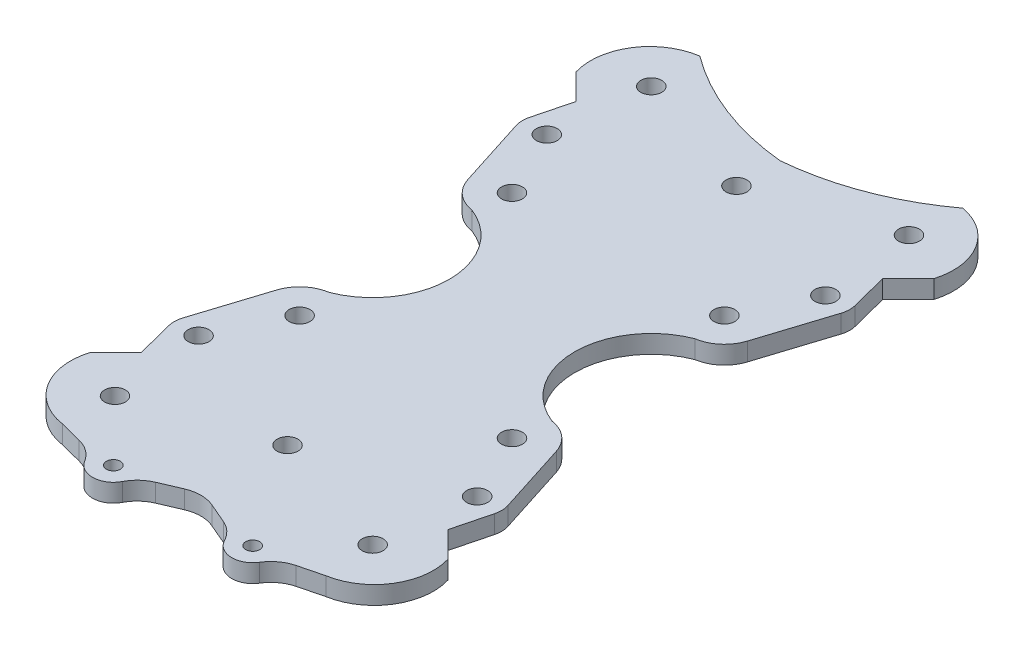
from build123d import *

# Parameters (mm, degrees)
SKETCH1_R           = 1.5
BOSS_EXTRUDE1_DEPTH = 2.6
BOSS_EXTRUDE2_START = -2.6
SKETCH2_R           = 1.5
BOSS_EXTRUDE2_DEPTH = 2.6
SKETCH3_R           = 1.5
SKETCH3_R_2         = 11
CUT_EXTRUDE2_DEPTH  = 2.6
SKETCH4_R           = 1.5
BOSS_EXTRUDE3_DEPTH = 2.6
BOSS_EXTRUDE5_START = -2.6
SKETCH5_R           = 1
BOSS_EXTRUDE5_DEPTH = 2.6
FILLET1_R           = 5


with BuildPart() as part:
    # Sketch1 → Boss-Extrude1 (new body)
    with BuildSketch(Plane(origin=(0, 0, 0), x_dir=(1, 0, 0), z_dir=(0, 1, 0))):
        with BuildLine():
            ThreePointArc((168.347792712, 1300.859692621), (159.343486253, 1295.942873675), (149.343647654, 1293.65030495))
            ThreePointArc((149.343647654, 1293.65030495), (139.460555114, 1295.990018463), (130.567766275, 1300.895941835))
            ThreePointArc((130.567766275, 1300.895941835), (124.616810573, 1297.0492589), (123.648598599, 1290.029756856))
            Line((123.648598599, 1290.029756856), (131.000501903, 1282.677853551))
            ThreePointArc((131.000501903, 1282.677853551), (132.734683914, 1280.082466761), (133.343647654, 1277.020999302))
            Line((133.343647654, 1277.020999302), (133.343647654, 1272.65030495))
            Line((133.343647654, 1272.65030495), (133.343647654, 1269.65030495))
            Line((133.343647654, 1269.65030495), (133.343647654, 1240.65030495))
            Line((133.343647654, 1240.65030495), (133.343647654, 1237.65030495))
            Line((133.343647654, 1237.65030495), (133.343647654, 1233.279610599))
            ThreePointArc((133.343647654, 1233.279610599), (132.734683914, 1230.21814314), (131.000501903, 1227.622756349))
            Line((131.000501903, 1227.622756349), (123.648598599, 1220.270853045))
            ThreePointArc((123.648598599, 1220.270853045), (124.616810573, 1213.251351001), (130.567766275, 1209.404668065))
            ThreePointArc((130.567766275, 1209.404668065), (139.460555114, 1214.310591438), (149.343647654, 1216.65030495))
            ThreePointArc((149.343647654, 1216.65030495), (159.343486253, 1214.357736226), (168.347792712, 1209.44091728))
            ThreePointArc((168.347792712, 1209.44091728), (174.131892083, 1213.349250607), (175.038696709, 1220.270853045))
            Line((175.038696709, 1220.270853045), (167.686793404, 1227.622756349))
            ThreePointArc((167.686793404, 1227.622756349), (165.952611394, 1230.21814314), (165.343647654, 1233.279610599))
            Line((165.343647654, 1233.279610599), (165.343647654, 1237.65030495))
            Line((165.343647654, 1237.65030495), (165.343647654, 1240.65030495))
            Line((165.343647654, 1240.65030495), (165.343647654, 1269.65030495))
            Line((165.343647654, 1269.65030495), (165.343647654, 1272.65030495))
            Line((165.343647654, 1272.65030495), (165.343647654, 1277.020999302))
            ThreePointArc((165.343647654, 1277.020999302), (165.952611394, 1280.082466761), (167.686793404, 1282.677853551))
            Line((167.686793404, 1282.677853551), (175.038696709, 1290.029756856))
            ThreePointArc((175.038696709, 1290.029756856), (174.131892083, 1296.951359294), (168.347792712, 1300.859692621))
        make_face()
        with Locations(Location((130.843647654, 1216.65030495, 0), (0, 0, 270))):
            Circle(SKETCH1_R, mode=Mode.SUBTRACT)
        with Locations(Location((149.343647654, 1222.919184261, 0), (0, 0, 270))):
            Circle(SKETCH1_R, mode=Mode.SUBTRACT)
        with Locations(Location((167.843647654, 1216.65030495, 0), (0, 0, 270))):
            Circle(SKETCH1_R, mode=Mode.SUBTRACT)
        with Locations(Location((130.843647654, 1293.65030495, 0), (0, 0, 270))):
            Circle(SKETCH1_R, mode=Mode.SUBTRACT)
        with Locations(Location((149.343647654, 1287.38142564, 0), (0, 0, 270))):
            Circle(SKETCH1_R, mode=Mode.SUBTRACT)
        with BuildLine():
            ThreePointArc((169.343647654, 1293.65030495), (167.843647654, 1292.15030495), (166.343647654, 1293.65030495))
            ThreePointArc((166.343647654, 1293.65030495), (167.843647654, 1295.15030495), (169.343647654, 1293.65030495))
        make_face(mode=Mode.SUBTRACT)
    extrude(amount=BOSS_EXTRUDE1_DEPTH)

    # Sketch2 → Boss-Extrude2 (add)
    # profile 1 of 4: a face of its own
    with BuildSketch(Plane(origin=(0, 2.6, 0), x_dir=(1, 0, 0), z_dir=(0, 1, 0)).offset(BOSS_EXTRUDE2_START)):
        with BuildLine():
            Line((171.362745056, 1223.946804697), (172.733437461, 1229.278912352))
            ThreePointArc((172.733437461, 1229.278912352), (172.109499611, 1232.295080685), (169.343647654, 1233.65030495))
            Line((169.343647654, 1233.65030495), (165.343647654, 1233.279610599))
            ThreePointArc((165.343647654, 1233.279610599), (165.952611394, 1230.21814314), (167.686793404, 1227.622756349))
            Line((167.686793404, 1227.622756349), (171.362745056, 1223.946804697))
        make_face()
        with Locations(Location((169.343647654, 1230.15030495, 0), (0, 0, 270))):
            Circle(SKETCH2_R, mode=Mode.SUBTRACT)
    # profile 2 of 4: a face of its own
    with BuildSketch(Plane(origin=(0, 2.6, 0), x_dir=(1, 0, 0), z_dir=(0, 1, 0)).offset(BOSS_EXTRUDE2_START)):
        with BuildLine():
            Line((127.324550251, 1223.946804697), (131.000501903, 1227.622756349))
            ThreePointArc((131.000501903, 1227.622756349), (132.734683914, 1230.21814314), (133.343647654, 1233.279610599))
            Line((133.343647654, 1233.279610599), (129.343647654, 1233.65030495))
            ThreePointArc((129.343647654, 1233.65030495), (126.577795697, 1232.295080685), (125.953857846, 1229.278912352))
            Line((125.953857846, 1229.278912352), (127.324550251, 1223.946804697))
        make_face()
        with Locations(Location((129.343647654, 1230.15030495, 0), (0, 0, 270))):
            Circle(SKETCH2_R, mode=Mode.SUBTRACT)
    # profile 3 of 4: a face of its own
    with BuildSketch(Plane(origin=(0, 2.6, 0), x_dir=(1, 0, 0), z_dir=(0, 1, 0)).offset(BOSS_EXTRUDE2_START)):
        with BuildLine():
            Line((171.362745056, 1286.353805203), (172.733437461, 1281.021697549))
            ThreePointArc((172.733437461, 1281.021697549), (172.109499611, 1278.005529215), (169.343647654, 1276.65030495))
            Line((169.343647654, 1276.65030495), (165.343647654, 1277.020999302))
            ThreePointArc((165.343647654, 1277.020999302), (165.952611394, 1280.082466761), (167.686793404, 1282.677853551))
            Line((167.686793404, 1282.677853551), (171.362745056, 1286.353805203))
        make_face()
        with Locations(Location((169.343647654, 1280.15030495, 0), (0, 0, 270))):
            Circle(SKETCH2_R, mode=Mode.SUBTRACT)
    # profile 4 of 4: a face of its own
    with BuildSketch(Plane(origin=(0, 2.6, 0), x_dir=(1, 0, 0), z_dir=(0, 1, 0)).offset(BOSS_EXTRUDE2_START)):
        with BuildLine():
            Line((127.324550251, 1286.353805203), (125.953857846, 1281.021697549))
            ThreePointArc((125.953857846, 1281.021697549), (126.577795697, 1278.005529215), (129.343647654, 1276.65030495))
            Line((129.343647654, 1276.65030495), (133.343647654, 1277.020999302))
            ThreePointArc((133.343647654, 1277.020999302), (132.734683914, 1280.082466761), (131.000501903, 1282.677853551))
            Line((131.000501903, 1282.677853551), (127.324550251, 1286.353805203))
        make_face()
        with Locations(Location((129.343647654, 1280.15030495, 0), (0, 0, 270))):
            Circle(SKETCH2_R, mode=Mode.SUBTRACT)
    extrude(amount=BOSS_EXTRUDE2_DEPTH)

    # Sketch3 → Cut-Extrude2 (cut)
    with BuildSketch(Plane(origin=(0, 2.6, 0), x_dir=(1, 0, 0), z_dir=(0, 1, 0))):
        with Locations((134.093647654, 1239.90030495)):
            Circle(SKETCH3_R)
        with Locations((164.593647654, 1239.90030495)):
            Circle(SKETCH3_R)
        with Locations((164.593647654, 1270.40030495)):
            Circle(SKETCH3_R)
        with Locations((134.093647654, 1270.40030495)):
            Circle(SKETCH3_R)
        with Locations((169.343647654, 1255.15030495)):
            Circle(SKETCH3_R_2)
        with Locations((129.343647654, 1255.15030495)):
            Circle(SKETCH3_R_2)
    extrude(amount=-CUT_EXTRUDE2_DEPTH, mode=Mode.SUBTRACT)

    # Sketch4 → Boss-Extrude3 (add)
    # profile 1 of 4: a face of its own
    with BuildSketch(Plane(origin=(0, 2.6, 0), x_dir=(1, 0, 0), z_dir=(0, 1, 0))):
        with BuildLine():
            Line((172.677777674, 1231.215000685), (169.412849314, 1241.439232174))
            ThreePointArc((169.412849314, 1241.439232174), (160.29790956, 1242.572314655), (165.343647654, 1234.897255716))
            Line((165.343647654, 1234.897255716), (165.343647654, 1233.279610599))
            Line((165.343647654, 1233.279610599), (169.343647654, 1233.65030495))
            ThreePointArc((169.343647654, 1233.65030495), (171.408056156, 1232.976648443), (172.677777674, 1231.215000685))
        make_face()
        with Locations(Location((164.593647654, 1239.90030495, 0), (0, 0, 270))):
            Circle(SKETCH4_R, mode=Mode.SUBTRACT)
    # profile 2 of 4: a face of its own
    with BuildSketch(Plane(origin=(0, 2.6, 0), x_dir=(1, 0, 0), z_dir=(0, 1, 0))):
        with BuildLine():
            Line((129.343647654, 1233.65030495), (133.343647654, 1233.279610599))
            Line((133.343647654, 1233.279610599), (133.343647654, 1234.897255716))
            ThreePointArc((133.343647654, 1234.897255716), (138.389385748, 1242.572314655), (129.274445994, 1241.439232174))
            Line((129.274445994, 1241.439232174), (126.009517634, 1231.215000685))
            ThreePointArc((126.009517634, 1231.215000685), (127.279239152, 1232.976648443), (129.343647654, 1233.65030495))
        make_face()
        with Locations(Location((134.093647654, 1239.90030495, 0), (0, 0, 270))):
            Circle(SKETCH4_R, mode=Mode.SUBTRACT)
    # profile 3 of 4: a face of its own
    with BuildSketch(Plane(origin=(0, 2.6, 0), x_dir=(1, 0, 0), z_dir=(0, 1, 0))):
        with BuildLine():
            Line((172.677777674, 1279.085609215), (169.412849314, 1268.861377727))
            ThreePointArc((169.412849314, 1268.861377727), (160.29790956, 1267.728295245), (165.343647654, 1275.403354184))
            Line((165.343647654, 1275.403354184), (165.343647654, 1277.020999302))
            Line((165.343647654, 1277.020999302), (169.343647654, 1276.65030495))
            ThreePointArc((169.343647654, 1276.65030495), (171.408056156, 1277.323961458), (172.677777674, 1279.085609215))
        make_face()
        with Locations(Location((164.593647654, 1270.40030495, 0), (0, 0, 270))):
            Circle(SKETCH4_R, mode=Mode.SUBTRACT)
    # profile 4 of 4: a face of its own
    with BuildSketch(Plane(origin=(0, 2.6, 0), x_dir=(1, 0, 0), z_dir=(0, 1, 0))):
        with BuildLine():
            Line((126.009517634, 1279.085609215), (129.274445994, 1268.861377727))
            ThreePointArc((129.274445994, 1268.861377727), (138.389385748, 1267.728295245), (133.343647654, 1275.403354184))
            Line((133.343647654, 1275.403354184), (133.343647654, 1277.020999302))
            Line((133.343647654, 1277.020999302), (129.343647654, 1276.65030495))
            ThreePointArc((129.343647654, 1276.65030495), (127.279239152, 1277.323961458), (126.009517634, 1279.085609215))
        make_face()
        with Locations(Location((134.093647654, 1270.40030495, 0), (0, 0, 270))):
            Circle(SKETCH4_R, mode=Mode.SUBTRACT)
    extrude(amount=-BOSS_EXTRUDE3_DEPTH)

    # Sketch5 → Boss-Extrude5 (add)
    with BuildSketch(Plane(origin=(0, 2.6, 0), x_dir=(1, 0, 0), z_dir=(0, 1, 0)).offset(BOSS_EXTRUDE5_START)):
        with BuildLine():
            Line((168.347792712, 1209.44091728), (162.343647654, 1207.919184261))
            ThreePointArc((162.343647654, 1207.919184261), (159.343647654, 1204.919184261), (156.343647654, 1207.919184261))
            Line((156.343647654, 1207.919184261), (149.343647654, 1210.919184261))
            Line((149.343647654, 1210.919184261), (142.343647654, 1207.919184261))
            ThreePointArc((142.343647654, 1207.919184261), (139.343647654, 1204.919184261), (136.343647654, 1207.919184261))
            Line((136.343647654, 1207.919184261), (130.567766275, 1209.404668065))
            ThreePointArc((130.567766275, 1209.404668065), (139.460555114, 1214.310591438), (149.343647654, 1216.65030495))
            ThreePointArc((149.343647654, 1216.65030495), (159.343486253, 1214.357736226), (168.347792712, 1209.44091728))
        make_face()
        with Locations(Location((139.343647654, 1207.919184261, 0), (0, 0, 270))):
            Circle(SKETCH5_R, mode=Mode.SUBTRACT)
        with Locations(Location((159.343647654, 1207.919184261, 0), (0, 0, 270))):
            Circle(SKETCH5_R, mode=Mode.SUBTRACT)
    extrude(amount=BOSS_EXTRUDE5_DEPTH)

    # Fillet1
    fillet1_edges = [part.edges().sort_by_distance(p)[0] for p in [
        (136.343647654, 1.3, -1207.919184261),
        (142.343647654, 1.3, -1207.919184261),
        (149.343647654, 1.3, -1210.919184261),
        (156.343647654, 1.3, -1207.919184261),
        (162.343647654, 1.3, -1207.919184261),
    ]]
    fillet(fillet1_edges, radius=FILLET1_R)


solid = part.part
